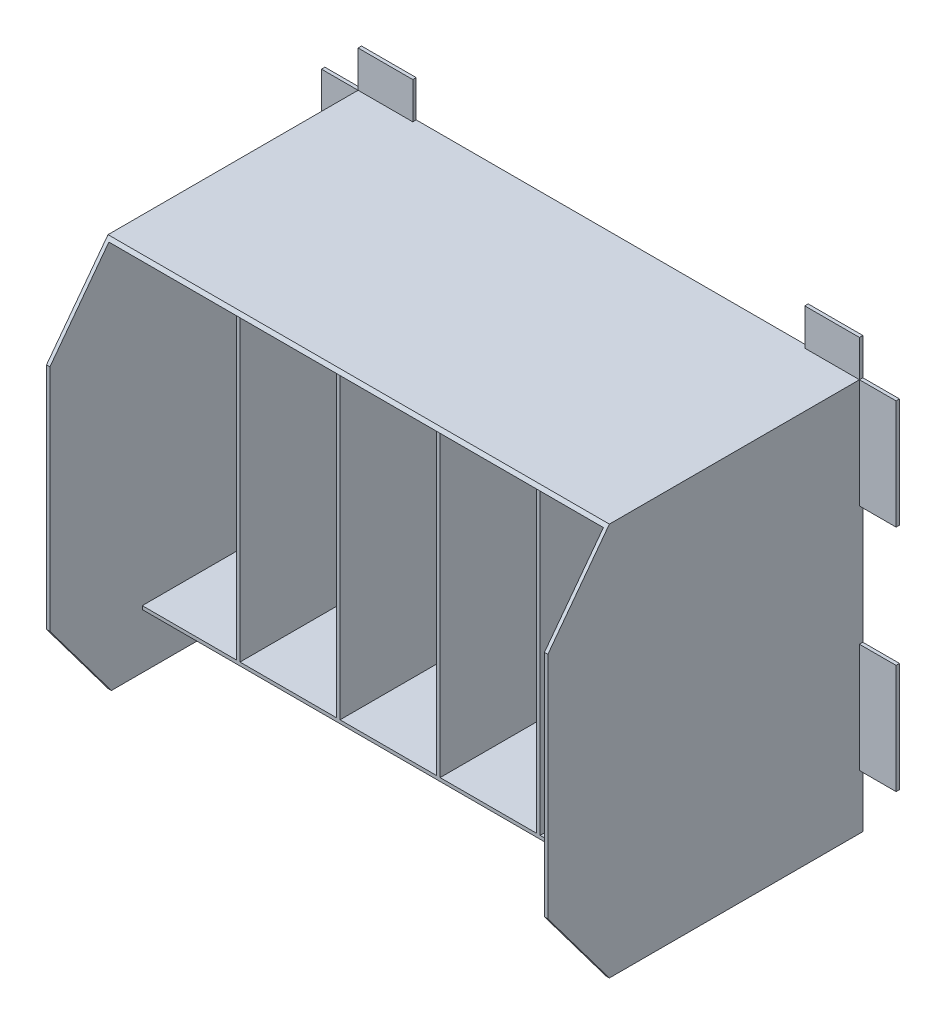
from build123d import *

# Parameters (mm, degrees)
SKETCH1_W           = 465.838
SKETCH1_H           = 365.232
BOSS_EXTRUDE1_DEPTH = 3.175
SKETCH2_W           = 465.838
SKETCH2_H           = 365.232
SKETCH2_W_2         = 459.488
SKETCH2_H_2         = 47.625
SKETCH2_W_3         = 89.789
SKETCH2_H_3         = 308.082
SKETCH2_W_4         = 87.632
BOSS_EXTRUDE2_DEPTH = 200.6
SKETCH4_W           = 459.488
SKETCH4_H           = 200.6
CUT_EXTRUDE1_DEPTH  = 3.175
SKETCH5_W           = 89.789
SKETCH5_H           = 308.082
SKETCH5_W_2         = 87.632
BOSS_EXTRUDE5_DEPTH = 38.1
CUT_EXTRUDE2_DEPTH  = 35
BOSS_EXTRUDE6_DEPTH = 50.8
CUT_EXTRUDE3_DEPTH  = 589.161843479
SKETCH10_W          = 34.036
SKETCH10_H          = 101.6
SKETCH10_W_2        = 50.8
SKETCH10_H_2        = 34.036
BOSS_EXTRUDE7_DEPTH = 3.175


with BuildPart() as part:
    # Sketch1 → Boss-Extrude1 (new body)
    with BuildSketch(Plane.XY):
        with Locations((-46.4825, -25.4)):
            Rectangle(SKETCH1_W, SKETCH1_H)
    extrude(amount=BOSS_EXTRUDE1_DEPTH)

    # Sketch2 → Boss-Extrude2 (add)
    with BuildSketch(Plane.XY.offset(3.175)):
        with Locations((-46.4825, -25.4)):
            Rectangle(SKETCH2_W, SKETCH2_H)
        with Locations((-46.4825, -181.0285)):
            Rectangle(SKETCH2_W_2, SKETCH2_H_2, mode=Mode.SUBTRACT)
        with Locations((138.367, 0)):
            Rectangle(SKETCH2_W_3, SKETCH2_H_3, mode=Mode.SUBTRACT)
        with Locations((45.403, 0)):
            Rectangle(SKETCH2_W_3, SKETCH2_H_3, mode=Mode.SUBTRACT)
        with Locations((-47.561, 0)):
            Rectangle(SKETCH2_W_3, SKETCH2_H_3, mode=Mode.SUBTRACT)
        with Locations((-140.525, 0)):
            Rectangle(SKETCH2_W_3, SKETCH2_H_3, mode=Mode.SUBTRACT)
        with Locations((-232.4105, 0)):
            Rectangle(SKETCH2_W_4, SKETCH2_H_3, mode=Mode.SUBTRACT)
    extrude(amount=BOSS_EXTRUDE2_DEPTH)

    # Sketch4 → Cut-Extrude1 (cut)
    with BuildSketch(Plane.XZ.offset(208.016)):
        with Locations((-46.4825, 103.475)):
            Rectangle(SKETCH4_W, SKETCH4_H)
    extrude(amount=-CUT_EXTRUDE1_DEPTH, mode=Mode.SUBTRACT)

    # Sketch5 → Boss-Extrude5 (add)
    with BuildSketch(Plane.XY.offset(203.775)):
        Polygon((186.4365, 157.216), (-279.4015, 157.216), (-279.4015, -208.016), (-276.2265, -208.016), (-276.2265, -157.216), (183.2615, -157.216), (183.2615, -208.016), (186.4365, -208.016), align=None)
        with Locations((-140.525, 0)):
            Rectangle(SKETCH5_W, SKETCH5_H, mode=Mode.SUBTRACT)
        with Locations((-47.561, 0)):
            Rectangle(SKETCH5_W, SKETCH5_H, mode=Mode.SUBTRACT)
        with Locations((45.403, 0)):
            Rectangle(SKETCH5_W, SKETCH5_H, mode=Mode.SUBTRACT)
        with Locations((138.367, 0)):
            Rectangle(SKETCH5_W, SKETCH5_H, mode=Mode.SUBTRACT)
        with Locations((-232.4105, 0)):
            Rectangle(SKETCH5_W_2, SKETCH5_H, mode=Mode.SUBTRACT)
    extrude(amount=BOSS_EXTRUDE5_DEPTH)

    # Sketch7 → Cut-Extrude2 (cut)
    with BuildSketch(Plane.XY.offset(241.875)):
        Polygon((-185.4195, -154.041), (-185.4195, 154.041), (-188.5945, 154.041), (-188.5945, -154.041), (-276.2265, -154.041), (-276.2265, -157.216), (183.2615, -157.216), (183.2615, -154.041), (93.4725, -154.041), (93.4725, 154.041), (90.2975, 154.041), (90.2975, -154.041), (0.5085, -154.041), (0.5085, 154.041), (-2.6665, 154.041), (-2.6665, -154.041), (-92.4555, -154.041), (-92.4555, 154.041), (-95.6305, 154.041), (-95.6305, -154.041), align=None)
    extrude(amount=-CUT_EXTRUDE2_DEPTH, mode=Mode.SUBTRACT)

    # Sketch8 → Boss-Extrude6 (add)
    with BuildSketch(Plane.XY.offset(241.875)):
        Polygon((183.2615, 154.041), (183.2615, -208.016), (186.4365, -208.016), (186.4365, 157.216), (-279.4015, 157.216), (-279.4015, -208.016), (-276.2265, -208.016), (-276.2265, 154.041), align=None)
    extrude(amount=BOSS_EXTRUDE6_DEPTH)

    # Sketch9 → Cut-Extrude3 (cut, through all)
    with BuildSketch(Plane(origin=(186.4365, 0, 0), x_dir=(0, 0, -1), z_dir=(1, 0, 0))):
        Polygon((-292.675, -208.016), (-235.525, -208.016), (-292.675, -131.816), align=None)
        Polygon((-292.675, 157.216), (-292.675, 81.016), (-235.525, 157.216), align=None)
    extrude(amount=-CUT_EXTRUDE3_DEPTH, mode=Mode.SUBTRACT)

    # Sketch10 → Boss-Extrude7 (add)
    with BuildSketch(Plane.XY):
        with Locations((203.4545, 106.416)):
            Rectangle(SKETCH10_W, SKETCH10_H)
        with Locations((203.4545, -106.416)):
            Rectangle(SKETCH10_W, SKETCH10_H)
        with Locations((161.0365, 174.234)):
            Rectangle(SKETCH10_W_2, SKETCH10_H_2)
    boss_extrude7 = extrude(amount=BOSS_EXTRUDE7_DEPTH)

    # Mirror1: Boss-Extrude7 across plane
    add(boss_extrude7.mirror(Plane.ZY.offset(46.4825)))


solid = part.part
